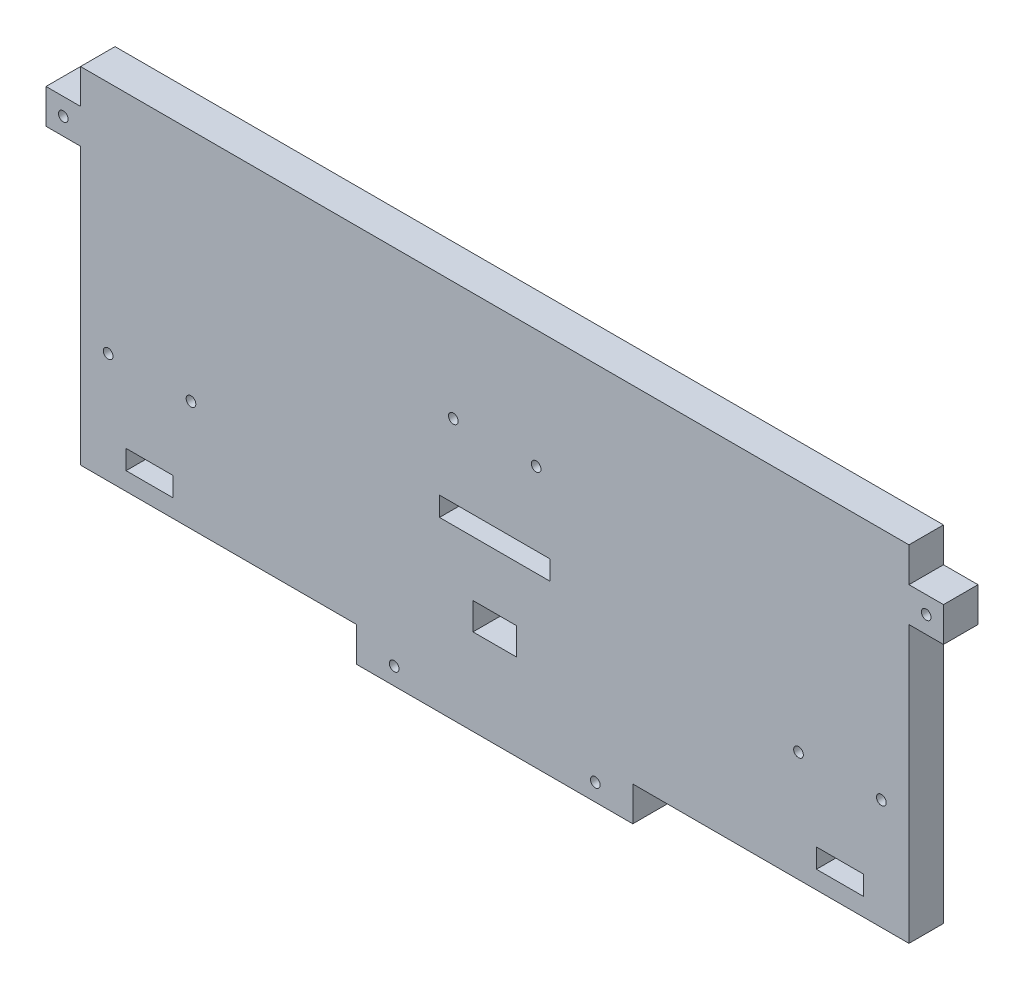
from build123d import *

# Parameters (mm, degrees)
SKETCH1_R           = 0.889
SKETCH1_W           = 8.636
SKETCH1_H           = 3.556
BOSS_EXTRUDE1_DEPTH = 6.35


with BuildPart() as part:
    # Sketch1 → Boss-Extrude1 (new body)
    with BuildSketch(Plane.XY):
        Polygon((-4.005119969, -10.063655938), (-4.005119969, 0.096344062), (-14.165119969, 0.096344062), (-14.165119969, 3.652344062), (-4.005119969, 3.652344062), (-4.005119969, 38.911344062), (-80.205119969, 38.911344062), (-80.205119969, 32.561344062), (-86.555119969, 32.561344062), (-86.555119969, 26.211344062), (-80.205119969, 26.211344062), (-80.205119969, -24.588655938), (-29.405119969, -24.588655938), (-29.405119969, -30.938655938), (-4.005119969, -30.938655938), (-4.005119969, -15.063655938), (-8.005119969, -15.063655938), (-8.005119969, -10.063655938), align=None)
        with Locations((-83.380119969, 29.386344062)):
            Circle(SKETCH1_R, mode=Mode.SUBTRACT)
        with Locations((-75.125119969, -4.268655938)):
            Circle(SKETCH1_R, mode=Mode.SUBTRACT)
        with Locations((-22.505119969, -27.763655938)):
            Circle(SKETCH1_R, mode=Mode.SUBTRACT)
        with Locations((-59.885119969, -4.268655938)):
            Circle(SKETCH1_R, mode=Mode.SUBTRACT)
        with Locations((-11.625119969, 17.114344062)):
            Circle(SKETCH1_R, mode=Mode.SUBTRACT)
        with Locations((-67.505119969, -19.508655938)):
            Rectangle(SKETCH1_W, SKETCH1_H, mode=Mode.SUBTRACT)
    boss_extrude1 = extrude(amount=BOSS_EXTRUDE1_DEPTH)

    # Mirror1: Boss-Extrude1 across plane
    add(boss_extrude1.mirror(Plane(origin=(-4.005119969, -10.063655938, 6.35), x_dir=(0, 0, 1), z_dir=(-1, 0, 0))))


solid = part.part
